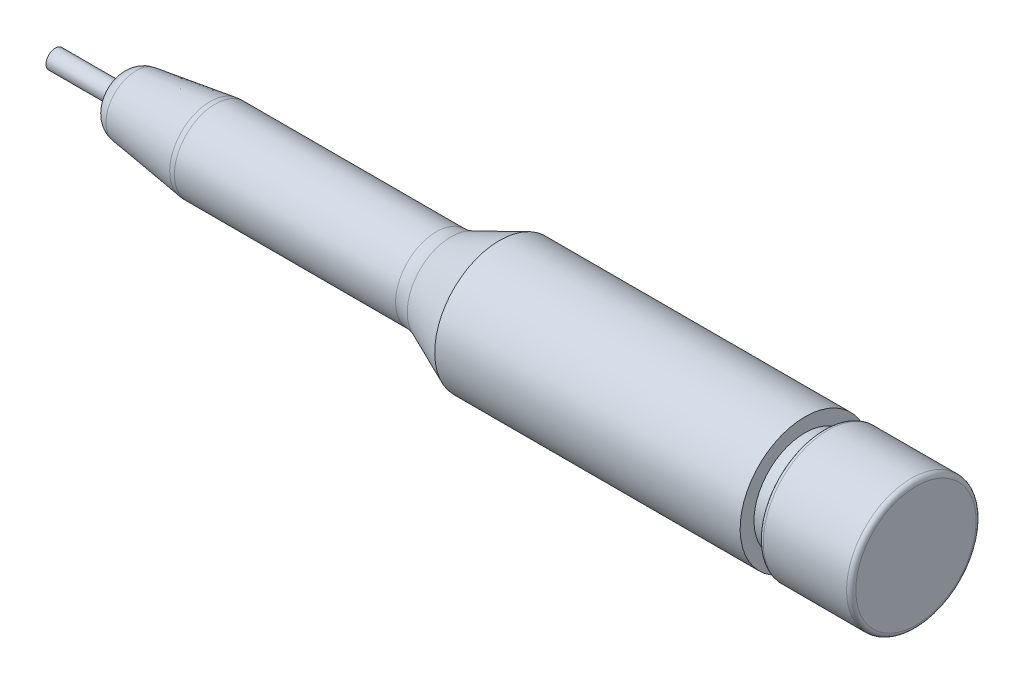
from build123d import *

# Parameters (mm, degrees)
FILETE1_R = 2
FILETE2_R = 4
FILETE3_R = 0.5


with BuildPart() as part:
    # Esboço1 → Revolução1 (revolve)
    with BuildSketch(Plane.XY):
        Polygon((0, 0), (0, 1), (7, 1), (7, 3), (17, 4.4), (42, 4.4), (48, 7), (81, 7), (81, 5.5), (83, 5.5), (83, 7), (93, 7), (93, 0), align=None)
    revolve(axis=Axis((93, 0, 0), (-1, 0, 0)))

    # Filete1
    filete1_edges = [part.edges().sort_by_distance(p)[0] for p in [
        (7, -3, 0),
    ]]
    fillet(filete1_edges, radius=FILETE1_R)

    # Filete2
    filete2_edges = [part.edges().sort_by_distance(p)[0] for p in [
        (42, -4.4, 0),
        (17, -4.4, 0),
    ]]
    fillet(filete2_edges, radius=FILETE2_R)

    # Filete3
    filete3_edges = [part.edges().sort_by_distance(p)[0] for p in [
        (93, -7, 0),
        (83, -7, 0),
    ]]
    fillet(filete3_edges, radius=FILETE3_R)


solid = part.part
